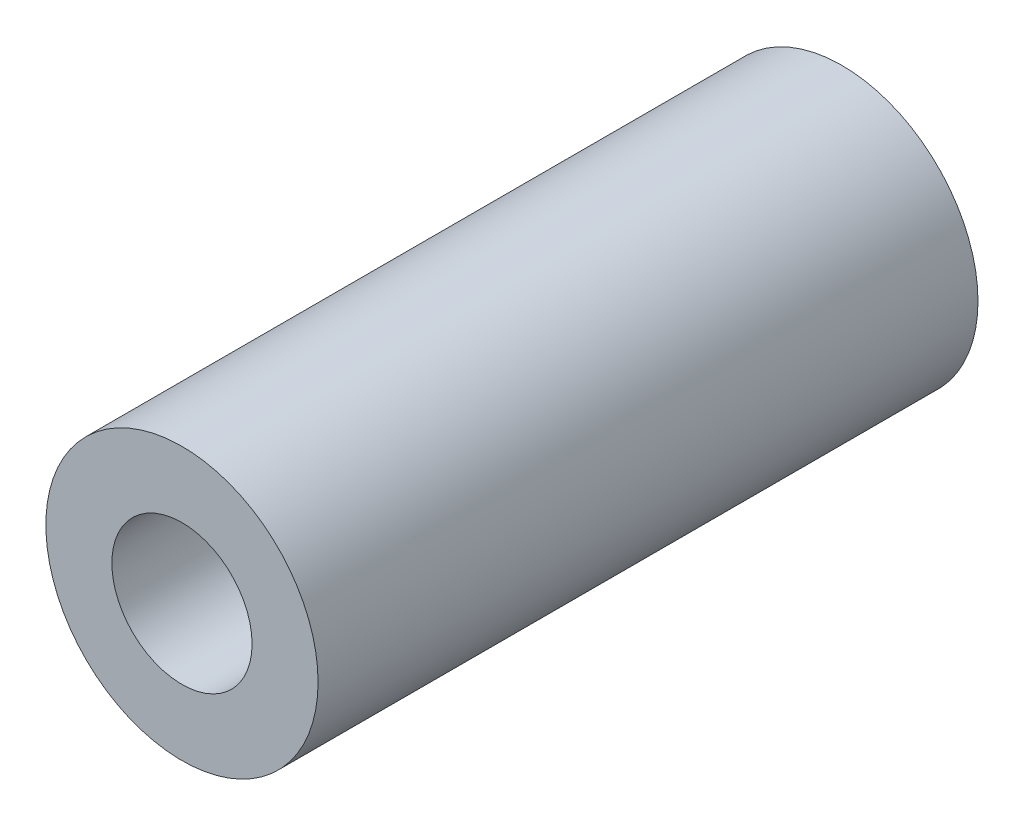
from build123d import *

# Parameters (mm, degrees)
SKETCH1_R           = 3.3
SKETCH1_R_2         = 1.7
BOSS_EXTRUDE1_DEPTH = 16


with BuildPart() as part:
    # Sketch1 → Boss-Extrude1 (new body)
    with BuildSketch(Plane.XY):
        Circle(SKETCH1_R)
        Circle(SKETCH1_R_2, mode=Mode.SUBTRACT)
    extrude(amount=BOSS_EXTRUDE1_DEPTH)


solid = part.part
